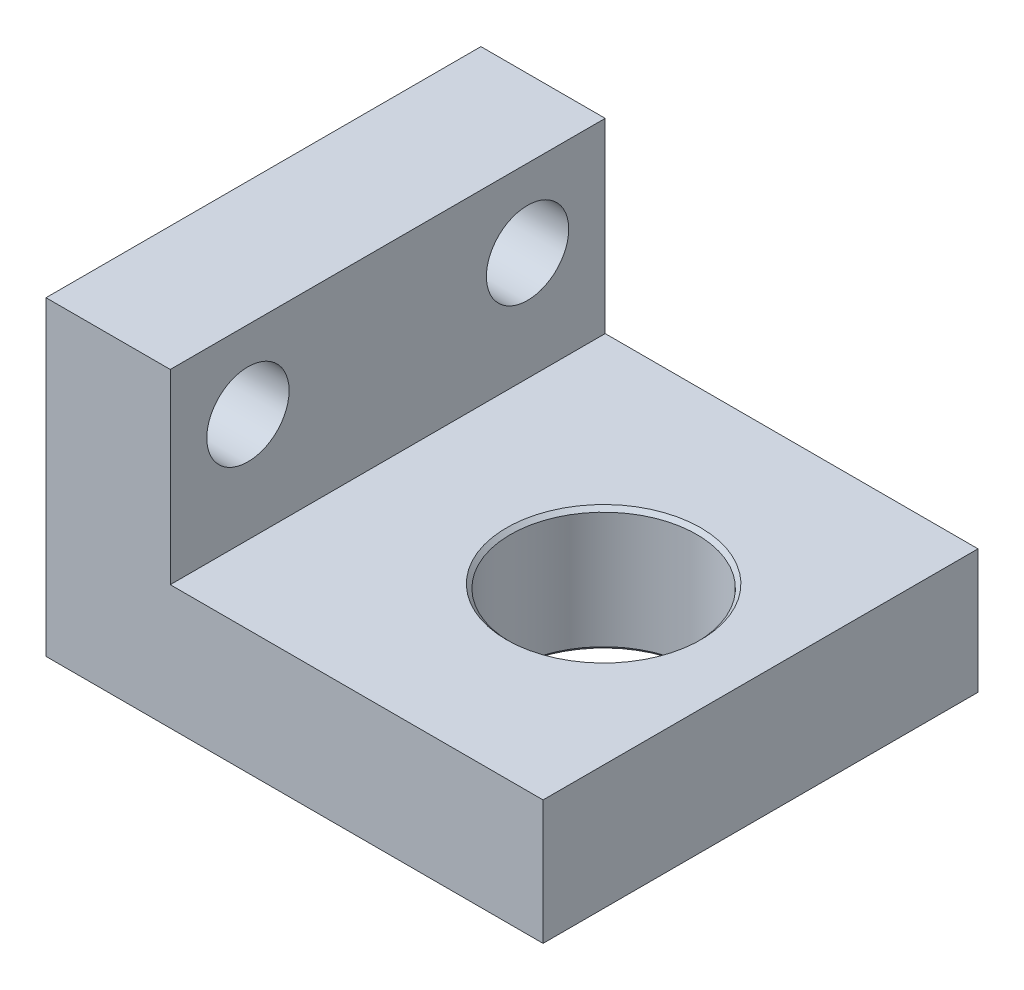
from build123d import *

# Parameters (mm, degrees)
SKETCH1_W            = 32
SKETCH1_H            = 28
BOSS_EXTRUDE1_DEPTH  = 8
SKETCH4_W            = 28
SKETCH4_H            = 20
BOSS_EXTRUDE2_DEPTH  = 8
M5_CLEARANCE_HOLE1_D = 5.3


with BuildPart() as part:
    # Sketch1 → Boss-Extrude1 (new body)
    with BuildSketch(Plane(origin=(0, 0, 0), x_dir=(1, 0, 0), z_dir=(0, 1, 0))):
        with Locations((-5.9, 0)):
            Rectangle(SKETCH1_W, SKETCH1_H)
    extrude(amount=BOSS_EXTRUDE1_DEPTH)

    # Sketch3 → Ø12.0 (12) Diameter Hole1 (revolve, cut)
    with BuildSketch(Plane(origin=(0, 8, 0), x_dir=(0, 0, 1), z_dir=(1, 0, 0))):
        Polygon((0, 0), (0, 8), (6.25, 8), (6, 7.75), (6, 0.25), (6.25, 0), align=None)
    revolve(axis=Axis((0, 14.35, 0), (0, -1, 0)), mode=Mode.SUBTRACT)

    # Sketch4 → Boss-Extrude2 (add)
    with BuildSketch(Plane.ZY.offset(21.9)):
        with Locations((0, 10)):
            Rectangle(SKETCH4_W, SKETCH4_H)
    extrude(amount=-BOSS_EXTRUDE2_DEPTH)

    # M5 Clearance Hole1 (through all)
    with Locations(Plane(origin=(-13.9, 0, 0), x_dir=(0, 0, -1), z_dir=(1, 0, 0))):
        with Locations((-9, 15), (9, 15)):
            Hole(M5_CLEARANCE_HOLE1_D / 2)


solid = part.part
